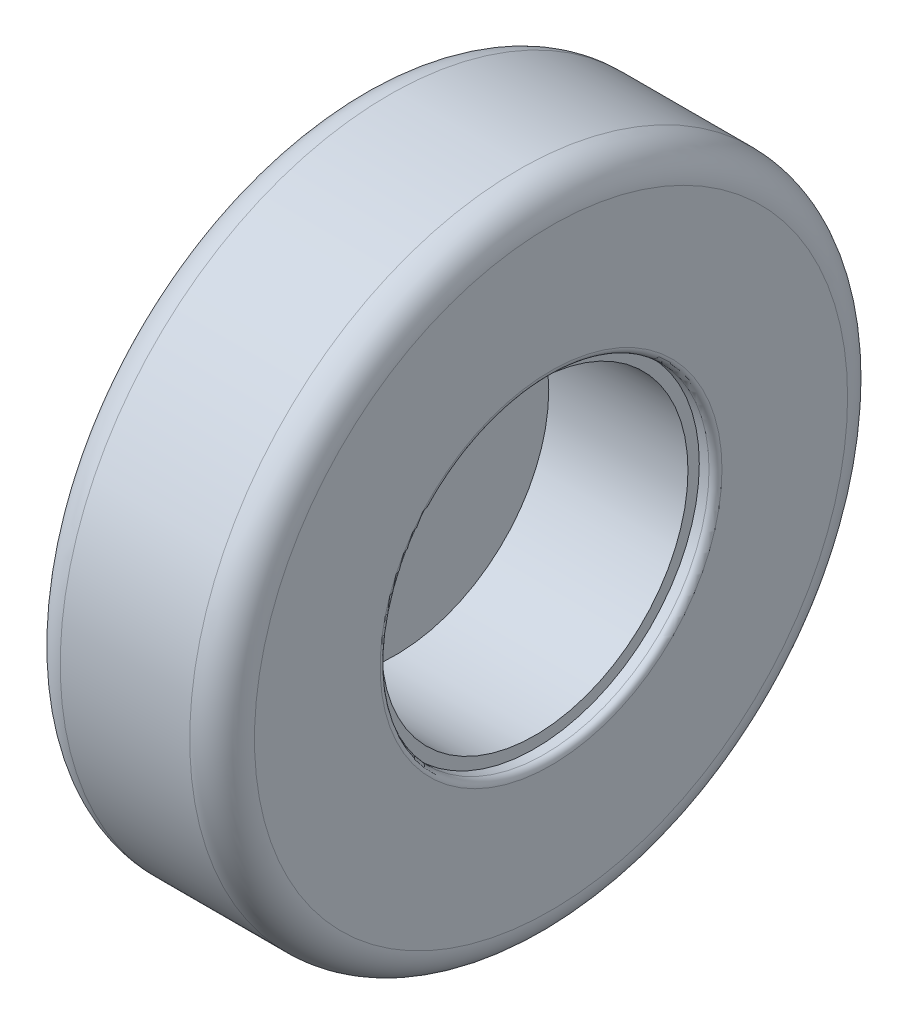
from build123d import *

# Parameters (mm, degrees)
HUB_START      = 5
SKETCH1_R      = 50.8
SKETCH1_R_2    = 7.625
HUB_FACE_DEPTH = 7
SKETCH2_R      = 50.8
SKETCH2_R_2    = 47.3
HUB_DEPTH      = 50
SKETCH3_R      = 101.6
SKETCH3_R_2    = 50.8
RUBBER_DEPTH   = 60
FILLET1_R      = 10
FILLET2_R      = 2


with BuildPart() as part:
    # Sketch1 → Hub Face (new body)
    with BuildSketch(Plane(origin=(0, 0, 0), x_dir=(0, 0, -1), z_dir=(1, 0, 0)).offset(HUB_START)):
        Circle(SKETCH1_R)
        Circle(SKETCH1_R_2, mode=Mode.SUBTRACT)
    extrude(amount=HUB_FACE_DEPTH)

    # Sketch2 → Hub (add)
    with BuildSketch(Plane(origin=(0, 0, 0), x_dir=(0, 0, -1), z_dir=(1, 0, 0)).offset(HUB_START)):
        Circle(SKETCH2_R)
        Circle(SKETCH2_R_2, mode=Mode.SUBTRACT)
    extrude(amount=HUB_DEPTH)

    # Sketch3 → Rubber (add)
    with BuildSketch(Plane(origin=(0, 0, 0), x_dir=(0, 0, -1), z_dir=(1, 0, 0))):
        Circle(SKETCH3_R)
        Circle(SKETCH3_R_2, mode=Mode.SUBTRACT)
    extrude(amount=RUBBER_DEPTH)

    # Fillet1
    fillet1_edges = [part.edges().sort_by_distance(p)[0] for p in [
        (60, 0, 101.6),
        (0, 0, 101.6),
    ]]
    fillet(fillet1_edges, radius=FILLET1_R)

    # Fillet2
    fillet2_edges = [part.edges().sort_by_distance(p)[0] for p in [
        (0, 0, 50.8),
        (60, 0, 50.8),
    ]]
    fillet(fillet2_edges, radius=FILLET2_R)


solid = part.part
